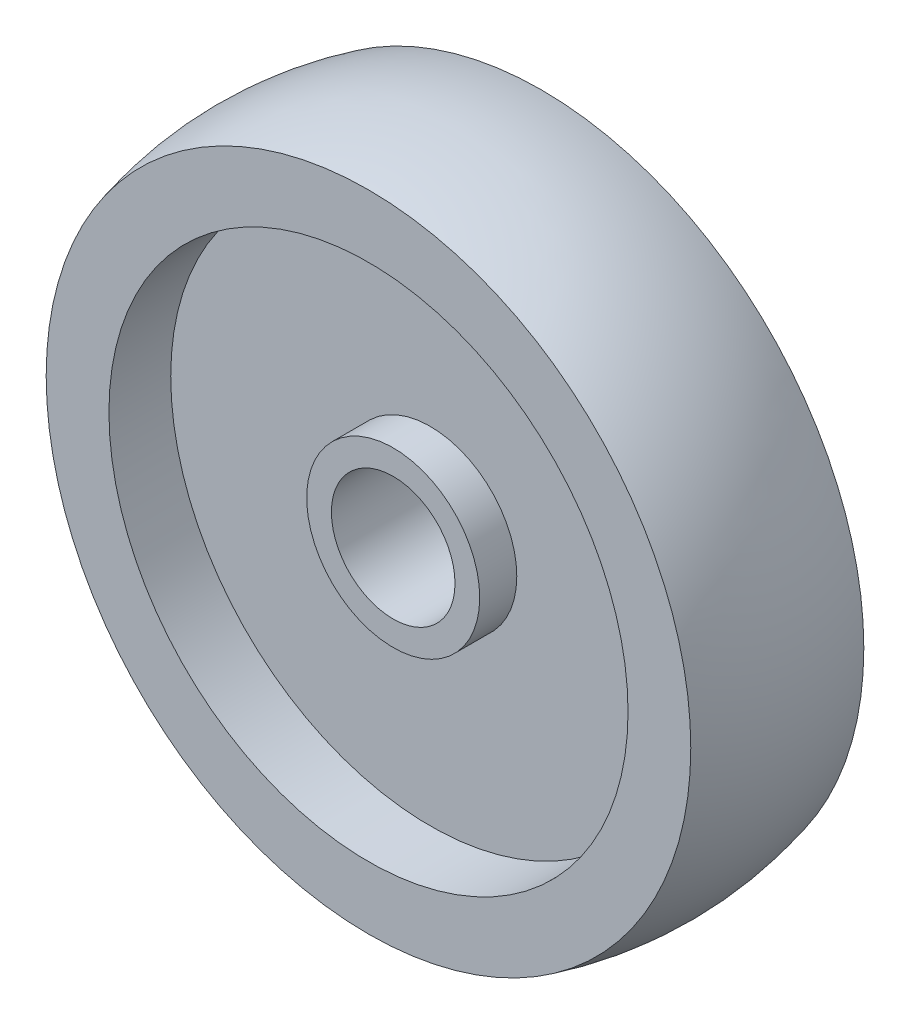
from build123d import *

# Parameters (mm, degrees)
SKETCH_1_R          = 27
SKETCH_1_R_2        = 5
EXTRUDE_1_DEPTH     = 7
SKETCH_4_R          = 21
CUT_EXTRUDE_1_DEPTH = 2
SKETCH_5_R          = 21
SKETCH_5_R_2        = 7
CUT_EXTRUDE_2_DEPTH = 3


with BuildPart() as part:
    # 草图1 → 凸台-拉伸1 (new, symmetric)
    with BuildSketch(Plane.XY):
        Circle(SKETCH_1_R)
        Circle(SKETCH_1_R_2, mode=Mode.SUBTRACT)
    extrude(amount=EXTRUDE_1_DEPTH, both=True)

    # 草图2 → 切除-旋转1 (revolve, cut)
    with BuildSketch(Plane(origin=(0, 0, 0), x_dir=(0, 0, -1), z_dir=(1, 0, 0))):
        with BuildLine():
            Line((-6.5814e-13, 27), (-7, 27))
            Line((-7, 27), (-7, 26.076809620810586))
            ThreePointArc((-7.0000000000000195, 26.07680962081059), (-3.530307368921202, 26.768207446165324), (-6.5782e-13, 27))
        make_face()
        with BuildLine():
            Line((7, 27), (-6.5814e-13, 27))
            ThreePointArc((-6.5782e-13, 27), (3.5303073689204805, 26.76820744616542), (6.999999999999878, 26.076809620810625))
            Line((7, 26.076809620810657), (7, 27))
        make_face()
    revolve(axis=Axis((0, 0, -7), (0, 0, 1)), mode=Mode.SUBTRACT)

    # 草图4 → 切除-拉伸1 (cut)
    with BuildSketch(Plane.XY.offset(7)):
        Circle(SKETCH_4_R)
    cut_extrude_1 = extrude(amount=-CUT_EXTRUDE_1_DEPTH, mode=Mode.SUBTRACT)

    # 草图5 → 切除-拉伸2 (cut)
    with BuildSketch(Plane.XY.offset(5)):
        Circle(SKETCH_5_R)
        Circle(SKETCH_5_R_2, mode=Mode.SUBTRACT)
    cut_extrude_2 = extrude(amount=-CUT_EXTRUDE_2_DEPTH, mode=Mode.SUBTRACT)

    # 镜向1: 切除-拉伸1, 切除-拉伸2 across plane
    add(cut_extrude_1.mirror(Plane.XY), mode=Mode.SUBTRACT)
    add(cut_extrude_2.mirror(Plane.XY), mode=Mode.SUBTRACT)


solid = part.part
